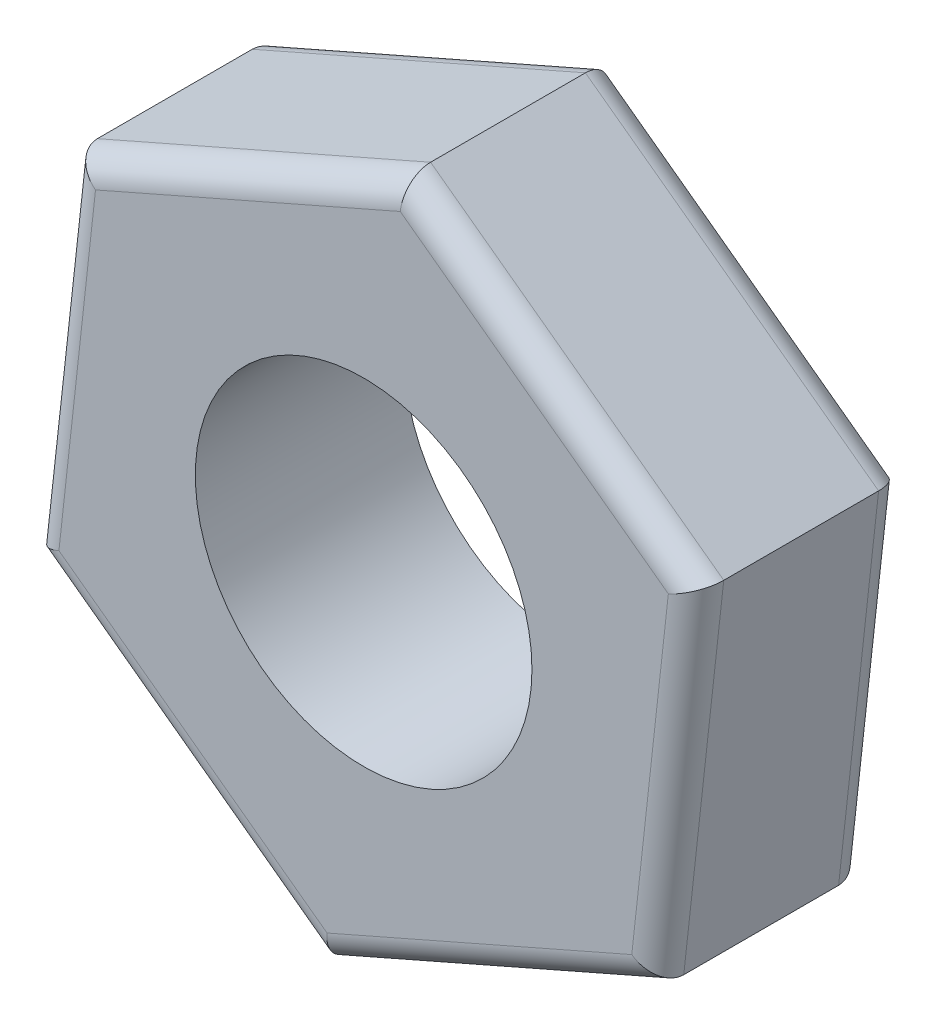
from build123d import *

# Parameters (mm, degrees)
BOSS_EXTRUDE1_DEPTH   = 1.55
FILLET1_R             = 0.2
F_2_5MM_DOWEL_HOLE1_D = 2.5


with BuildPart() as part:
    # Sketch1 → Boss-Extrude1 (new body)
    with BuildSketch(Plane.XY):
        Polygon((0.297131561, 2.68561219), (-2.177242601, 1.600129575), (-2.474374162, -1.085482615), (-0.297131561, -2.68561219), (2.177242601, -1.600129575), (2.474374162, 1.085482615), align=None)
    extrude(amount=BOSS_EXTRUDE1_DEPTH)

    # Fillet1
    fillet1_edges = [part.edges().sort_by_distance(p)[0] for p in [
        (-2.325808381, 0.25732348, 1.55),
        (-1.385752862, -1.885547402, 1.55),
        (0.94005552, -2.142870883, 1.55),
        (2.325808381, -0.25732348, 1.55),
        (1.385752862, 1.885547402, 1.55),
        (2.325808381, -0.25732348, 0),
        (0.94005552, -2.142870883, 0),
        (-1.385752862, -1.885547402, 0),
        (-0.94005552, 2.142870883, 1.55),
        (-2.325808381, 0.25732348, 0),
        (-0.94005552, 2.142870883, 0),
        (1.385752862, 1.885547402, 0),
    ]]
    fillet(fillet1_edges, radius=FILLET1_R)

    # Ø2.5mm Dowel Hole1 (through all)
    with Locations(Plane.XY.offset(1.55)):
        with Locations((0, 0)):
            Hole(F_2_5MM_DOWEL_HOLE1_D / 2)


solid = part.part
